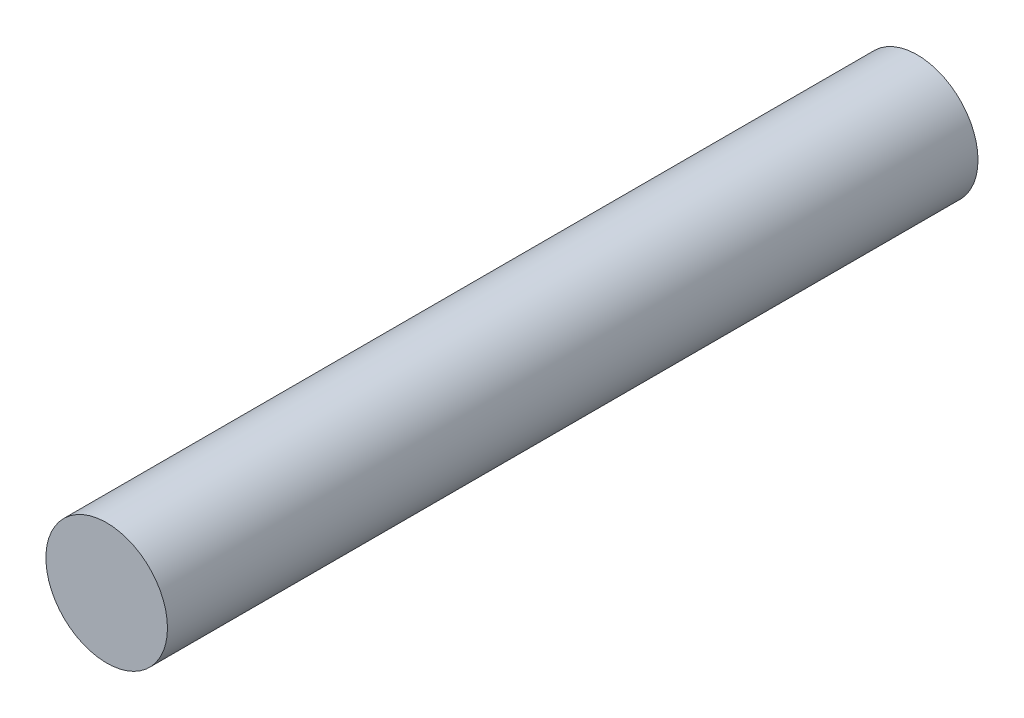
from build123d import *

# Parameters (mm, degrees)
SKETCH1_R           = 0.75
BOSS_EXTRUDE1_DEPTH = 10


with BuildPart() as part:
    # Sketch1 → Boss-Extrude1 (new body)
    with BuildSketch(Plane.XY):
        Circle(SKETCH1_R)
    extrude(amount=BOSS_EXTRUDE1_DEPTH)


solid = part.part
